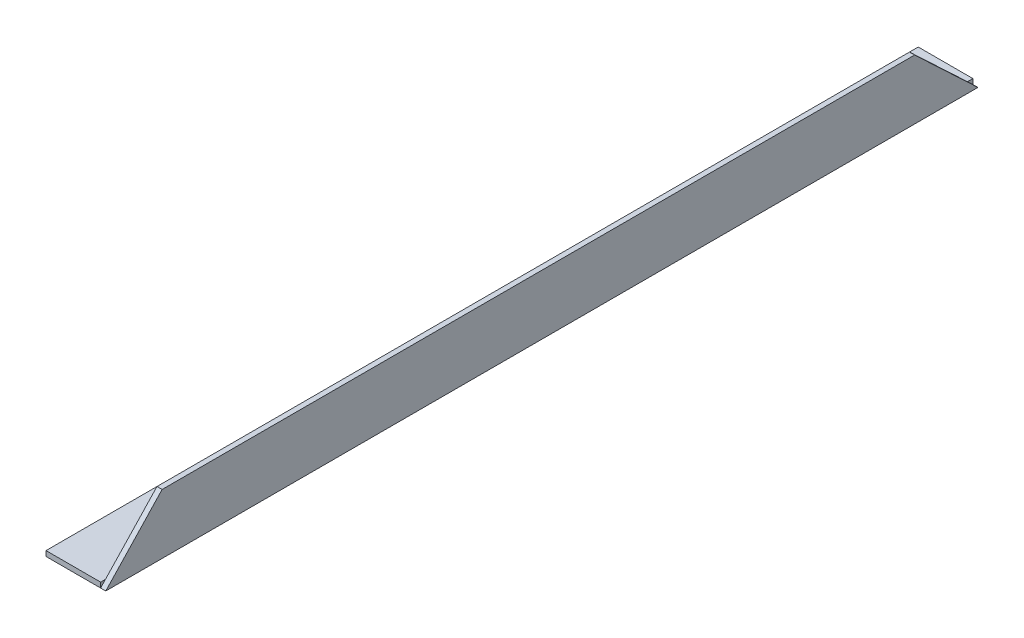
from build123d import *

# Parameters (mm, degrees)
BOSS_EXTRUDE1_DEPTH = 2
SKETCH2_W           = 340
SKETCH2_H           = 2
BOSS_EXTRUDE2_DEPTH = 21.3


with BuildPart() as part:
    # Sketch1 → Boss-Extrude1 (new body)
    with BuildSketch(Plane(origin=(0, 0, 0), x_dir=(0, 0, -1), z_dir=(1, 0, 0))):
        Polygon((-198.982035928, 0), (141.017964072, 0), (116.300201593, 23.3), (-177.018478326, 23.3), align=None)
    extrude(amount=BOSS_EXTRUDE1_DEPTH)

    # Sketch2 → Boss-Extrude2 (add)
    with BuildSketch(Plane.ZY):
        with Locations((28.982035928, 1)):
            Rectangle(SKETCH2_W, SKETCH2_H)
    extrude(amount=BOSS_EXTRUDE2_DEPTH)


solid = part.part
